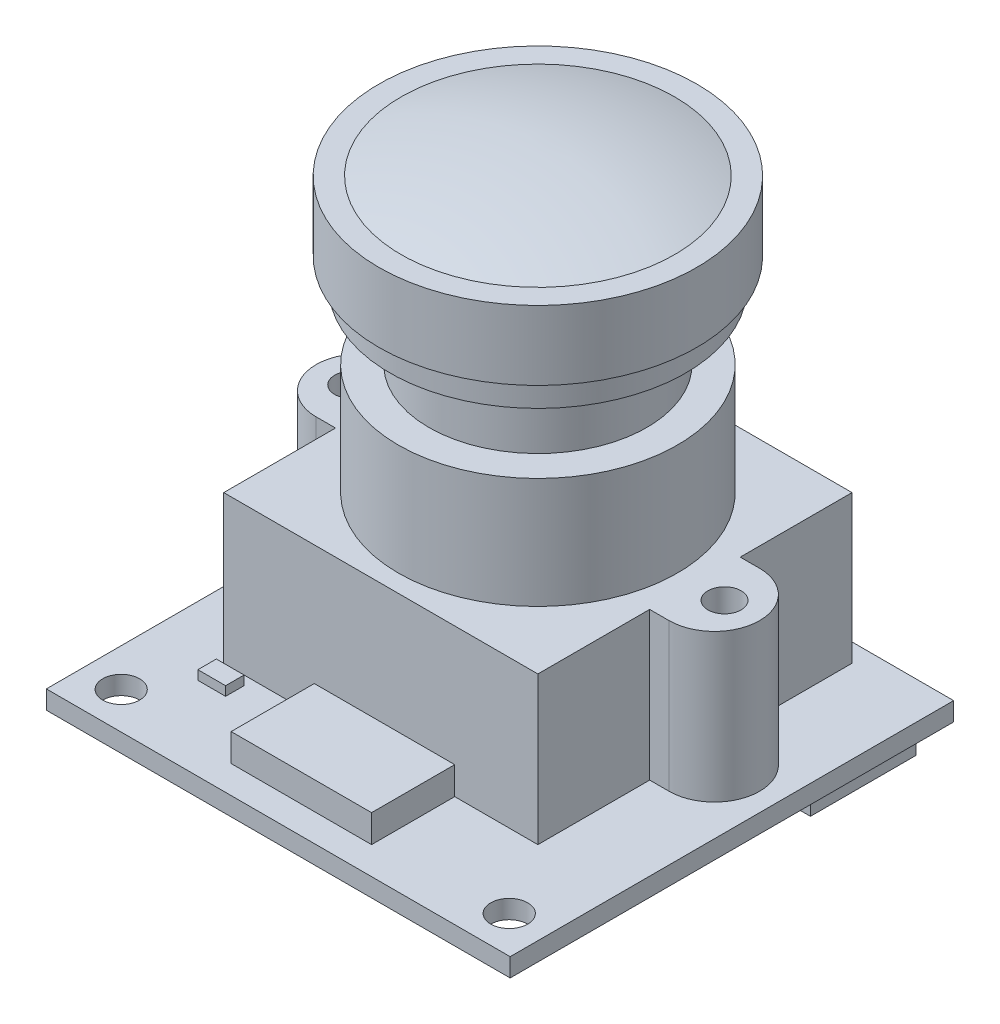
from build123d import *

# Parameters (mm, degrees)
SKETCH2_R                = 0.9
BOSS_EXTRUDE1_DEPTH      = 8
BOSS_EXTRUDE2_REACH      = 28.314
BOSS_EXTRUDE2_END_RADIUS = 7.55
SKETCH3_W                = 2.5
SKETCH3_H                = 6
SKETCH4_R                = 0.5
CUT_EXTRUDE1_DEPTH       = 8
SKETCH5_W                = 25.1
SKETCH5_H                = 24
BOSS_EXTRUDE3_DEPTH      = 1
SKETCH6_W                = 7.6
SKETCH6_H                = 4.5
BOSS_EXTRUDE4_DEPTH      = 1.5
SKETCH7_R                = 1
CUT_EXTRUDE2_DEPTH       = 31.907118921
SKETCH8_W                = 1.5
SKETCH8_H                = 1
BOSS_EXTRUDE5_DEPTH      = 0.5
SKETCH9_W                = 21
SKETCH9_H                = 5.7
BOSS_EXTRUDE6_DEPTH      = 2.6


with BuildPart() as part:
    # Sketch1 → Revolve1 (revolve)
    with BuildSketch(Plane(origin=(0, 0, 0), x_dir=(0, 0, -1), z_dir=(1, 0, 0))):
        with BuildLine():
            Line((0, 0), (0, 16))
            ThreePointArc((0, 16), (3.744412504, 15.710784808), (7.4, 14.85))
            Line((7.4, 14.85), (8.6, 14.85))
            Line((8.6, 14.85), (8.6, 11.1))
            Line((8.6, 11.1), (8, 11.1))
            Line((8, 11.1), (8, 9.6))
            Line((8, 9.6), (5.9, 9.6))
            Line((5.9, 9.6), (5.9, 6))
            Line((5.9, 6), (7.55, 6))
            Line((7.55, 6), (7.55, 0))
            Line((7.55, 0), (0, 0))
        make_face()
    revolve(axis=Axis((0, 0, 0), (0, 1, 0)))

    # Sketch2 → Boss-Extrude1 (add)
    with BuildSketch(Plane.XZ):
        with BuildLine():
            Line((-8.5, -8.5), (8.5, -8.5))
            Line((8.5, -8.5), (8.5, -2.45))
            Line((8.5, -2.45), (9.55, -2.45))
            ThreePointArc((9.55, -2.45), (12, 0), (9.55, 2.45))
            Line((9.55, 2.45), (8.5, 2.45))
            Line((8.5, 2.45), (8.5, 8.5))
            Line((8.5, 8.5), (-8.5, 8.5))
            Line((-8.5, 8.5), (-8.5, 2.45))
            Line((-8.5, 2.45), (-9.55, 2.45))
            ThreePointArc((-9.55, 2.45), (-12, 0), (-9.55, -2.45))
            Line((-9.55, -2.45), (-8.5, -2.45))
            Line((-8.5, -2.45), (-8.5, -8.5))
        make_face()
        with Locations(Location((-10.1, 0, 0), (0, 0, 270))):
            Circle(SKETCH2_R, mode=Mode.SUBTRACT)
        with Locations(Location((10.1, 0, 0), (0, 0, 270))):
            Circle(SKETCH2_R, mode=Mode.SUBTRACT)
    extrude(amount=BOSS_EXTRUDE1_DEPTH)

    # Boss-Extrude2: up to this cylinder (the profile starts outside it)
    boss_extrude2_end = Plane(origin=(0, 3, 0), z_dir=(0, -1, 0)) * Cylinder(BOSS_EXTRUDE2_END_RADIUS, 72.728, mode=Mode.PRIVATE)
    # Sketch3 → Boss-Extrude2 (add, up to the surface)
    with BuildSketch(Plane(origin=(0, 0, -8.5), x_dir=(-1, 0, 0), z_dir=(0, 0, -1)), mode=Mode.PRIVATE) as boss_extrude2_sk1:
        with Locations((0, 3)):
            Rectangle(SKETCH3_W, SKETCH3_H)
    boss_extrude2_tool1 = extrude(boss_extrude2_sk1.sketch, amount=-BOSS_EXTRUDE2_REACH, mode=Mode.PRIVATE) - boss_extrude2_end
    add(boss_extrude2_tool1.solids().sort_by_distance((0, 3, -8.5))[0])

    # Sketch4 → Cut-Extrude1 (cut)
    with BuildSketch(Plane(origin=(0, 0, -8.5), x_dir=(-1, 0, 0), z_dir=(0, 0, -1))):
        with Locations((0, 3.75)):
            Circle(SKETCH4_R)
    extrude(amount=-CUT_EXTRUDE1_DEPTH, mode=Mode.SUBTRACT)

    # Sketch5 → Boss-Extrude3 (add)
    with BuildSketch(Plane.XZ.offset(8)):
        with Locations((0.45, 2.5)):
            Rectangle(SKETCH5_W, SKETCH5_H)
    extrude(amount=BOSS_EXTRUDE3_DEPTH)

    # Sketch6 → Boss-Extrude4 (add)
    with BuildSketch(Plane(origin=(0, -8, 0), x_dir=(1, 0, 0), z_dir=(0, 1, 0))):
        with Locations((0.2, -10.75)):
            Rectangle(SKETCH6_W, SKETCH6_H)
    extrude(amount=BOSS_EXTRUDE4_DEPTH)

    # Sketch7 → Cut-Extrude2 (cut, through all)
    with BuildSketch(Plane(origin=(0, -8, 0), x_dir=(1, 0, 0), z_dir=(0, 1, 0))):
        with Locations(Location((-10.05, -12.5, 0), (0, 0, 270))):
            Circle(SKETCH7_R)
        with Locations(Location((10.95, -12.5, 0), (0, 0, 270))):
            Circle(SKETCH7_R)
    extrude(amount=-CUT_EXTRUDE2_DEPTH, mode=Mode.SUBTRACT)

    # Sketch8 → Boss-Extrude5 (add)
    with BuildSketch(Plane(origin=(0, -8, 0), x_dir=(1, 0, 0), z_dir=(0, 1, 0))):
        with Locations((-7.65, -9.5)):
            Rectangle(SKETCH8_W, SKETCH8_H)
    extrude(amount=BOSS_EXTRUDE5_DEPTH)

    # Sketch9 → Boss-Extrude6 (add)
    with BuildSketch(Plane.XZ.offset(9)):
        with Locations((0.45, -6.65)):
            Rectangle(SKETCH9_W, SKETCH9_H)
    extrude(amount=BOSS_EXTRUDE6_DEPTH)


solid = part.part
